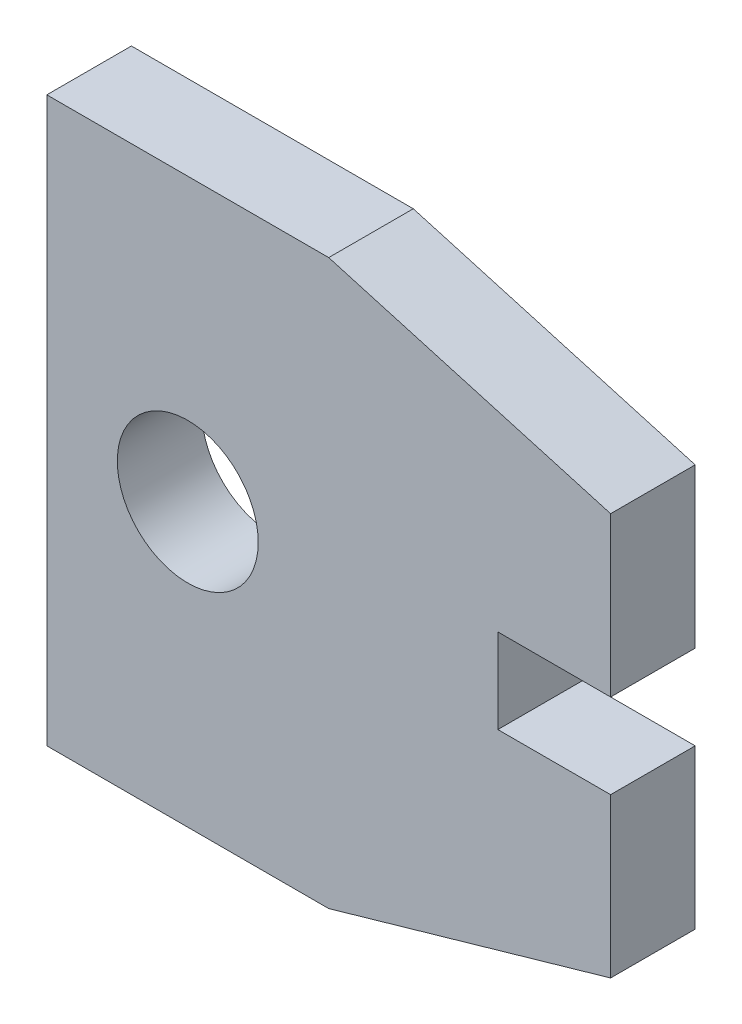
from build123d import *

# Parameters (mm, degrees)
SKETCH1_R           = 2.5
BOSS_EXTRUDE1_DEPTH = 3
SKETCH2_W           = 5
SKETCH2_H           = 1
BOSS_EXTRUDE2_DEPTH = 3
SKETCH3_W           = 1
SKETCH3_H           = 3
BOSS_EXTRUDE3_DEPTH = 3


with BuildPart() as part:
    # Sketch1 → Boss-Extrude1 (new body)
    with BuildSketch(Plane.XY):
        Polygon((0, 10), (10, 7.132546142), (10, 2.5), (5, 2.5), (5, -2.5), (10, -2.5), (10, -7.132546142), (0, -10), (-10, -10), (-10, 10), align=None)
        with Locations((-5, 0)):
            Circle(SKETCH1_R, mode=Mode.SUBTRACT)
    extrude(amount=BOSS_EXTRUDE1_DEPTH)

    # Sketch2 → Boss-Extrude2 (add)
    with BuildSketch(Plane(origin=(0, 0, 0), x_dir=(-1, 0, 0), z_dir=(0, 0, -1))):
        with Locations((-7.5, 2)):
            Rectangle(SKETCH2_W, SKETCH2_H)
        with Locations((-7.5, -2)):
            Rectangle(SKETCH2_W, SKETCH2_H)
    extrude(amount=-BOSS_EXTRUDE2_DEPTH)

    # Sketch3 → Boss-Extrude3 (add)
    with BuildSketch(Plane(origin=(0, 0, 0), x_dir=(-1, 0, 0), z_dir=(0, 0, -1))):
        with Locations((-5.5, 0)):
            Rectangle(SKETCH3_W, SKETCH3_H)
    extrude(amount=-BOSS_EXTRUDE3_DEPTH)


solid = part.part
